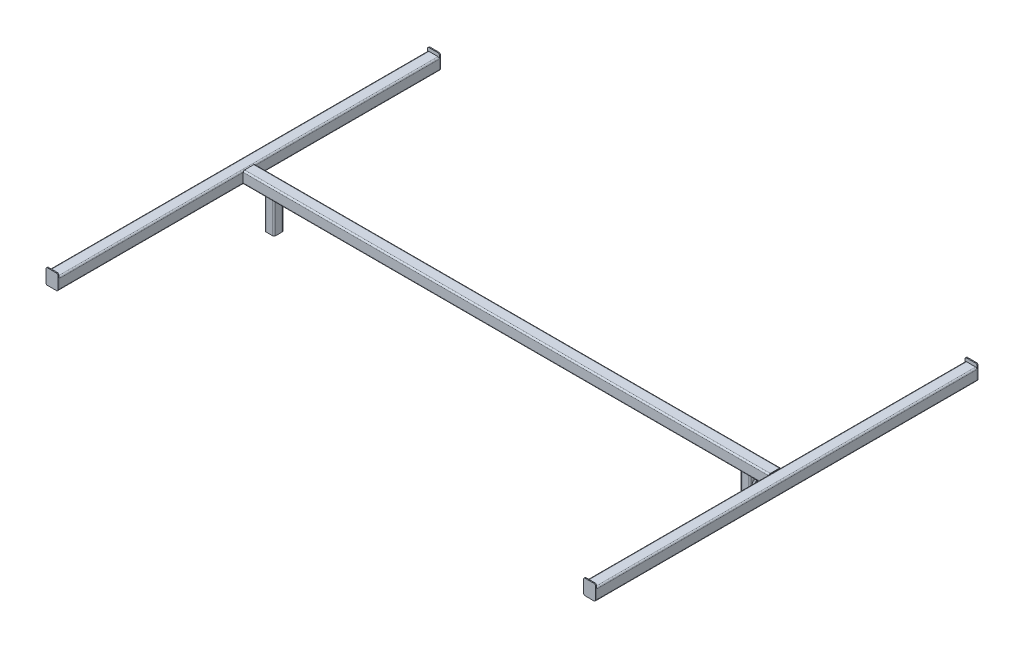
from build123d import *

# Parameters (mm, degrees)
F_2_X_2_X_0_25_1_DEPTH   = 800
F_2_X_2_X_0_25_1_2_DEPTH = 800
F_2_X_2_X_0_25_1_3_DEPTH = 1132
F_2_X_2_X_0_25_2_DEPTH   = 77.5
F_2_X_2_X_0_25_2_2_DEPTH = 77.5
EXTRUDE_1_DEPTH          = 2
CUT_EXTRUDE_3_DEPTH      = 1.5
CUT_EXTRUDE_4_DEPTH      = 1.5


with BuildPart() as part:
    # Sketch1 → Квадратная труба 2 X 2 X 0.25(1) (new body)
    with BuildSketch(Plane(origin=(-565, 0, -400), x_dir=(1, 0, 0), z_dir=(0, 0, 1))):
        with BuildLine():
            Line((-9.5, -12.5), (9.5, -12.5))
            ThreePointArc((9.5, -12.5), (11.621320344, -11.621320344), (12.5, -9.5))
            Line((12.5, -9.5), (12.5, 9.5))
            ThreePointArc((12.5, 9.5), (11.621320344, 11.621320344), (9.5, 12.5))
            Line((9.5, 12.5), (-9.5, 12.5))
            ThreePointArc((-9.5, 12.5), (-11.621320344, 11.621320344), (-12.5, 9.5))
            Line((-12.5, 9.5), (-12.5, -9.5))
            ThreePointArc((-12.5, -9.5), (-11.621320344, -11.621320344), (-9.5, -12.5))
        make_face()
        with BuildLine():
            Line((-9.5, -10.5), (9.5, -10.5))
            ThreePointArc((9.5, -10.5), (10.207106781, -10.207106781), (10.5, -9.5))
            Line((10.5, -9.5), (10.5, 9.5))
            ThreePointArc((10.5, 9.5), (10.207106781, 10.207106781), (9.5, 10.5))
            Line((9.5, 10.5), (-9.5, 10.5))
            ThreePointArc((-9.5, 10.5), (-10.207106781, 10.207106781), (-10.5, 9.5))
            Line((-10.5, 9.5), (-10.5, -9.5))
            ThreePointArc((-10.5, -9.5), (-10.207106781, -10.207106781), (-9.5, -10.5))
        make_face(mode=Mode.SUBTRACT)
    extrude(amount=F_2_X_2_X_0_25_1_DEPTH)


with BuildPart() as body_2:
    # Sketch1 on segment 2 (carried to segment 2) → 2 X 2 X 0.25_1 2 (new body)
    with BuildSketch(Plane(origin=(565, 0, -400), x_dir=(1, 0, 0), z_dir=(0, 0, 1))):
        with BuildLine():
            Line((-9.5, -12.5), (9.5, -12.5))
            ThreePointArc((9.5, -12.5), (11.621320344, -11.621320344), (12.5, -9.5))
            Line((12.5, -9.5), (12.5, 9.5))
            ThreePointArc((12.5, 9.5), (11.621320344, 11.621320344), (9.5, 12.5))
            Line((9.5, 12.5), (-9.5, 12.5))
            ThreePointArc((-9.5, 12.5), (-11.621320344, 11.621320344), (-12.5, 9.5))
            Line((-12.5, 9.5), (-12.5, -9.5))
            ThreePointArc((-12.5, -9.5), (-11.621320344, -11.621320344), (-9.5, -12.5))
        make_face()
        with BuildLine():
            Line((-9.5, -10.5), (9.5, -10.5))
            ThreePointArc((9.5, -10.5), (10.207106781, -10.207106781), (10.5, -9.5))
            Line((10.5, -9.5), (10.5, 9.5))
            ThreePointArc((10.5, 9.5), (10.207106781, 10.207106781), (9.5, 10.5))
            Line((9.5, 10.5), (-9.5, 10.5))
            ThreePointArc((-9.5, 10.5), (-10.207106781, 10.207106781), (-10.5, 9.5))
            Line((-10.5, 9.5), (-10.5, -9.5))
            ThreePointArc((-10.5, -9.5), (-10.207106781, -10.207106781), (-9.5, -10.5))
        make_face(mode=Mode.SUBTRACT)
    extrude(amount=F_2_X_2_X_0_25_1_2_DEPTH)


with BuildPart() as body_3:
    # Sketch1 on segment 3 (carried to segment 3) → 2 X 2 X 0.25_1 3 (new body)
    with BuildSketch(Plane(origin=(-566, 0, 0), x_dir=(0, 0, -1), z_dir=(1, 0, 0))):
        with BuildLine():
            Line((-9.5, -12.5), (9.5, -12.5))
            ThreePointArc((9.5, -12.5), (11.621320344, -11.621320344), (12.5, -9.5))
            Line((12.5, -9.5), (12.5, 9.5))
            ThreePointArc((12.5, 9.5), (11.621320344, 11.621320344), (9.5, 12.5))
            Line((9.5, 12.5), (-9.5, 12.5))
            ThreePointArc((-9.5, 12.5), (-11.621320344, 11.621320344), (-12.5, 9.5))
            Line((-12.5, 9.5), (-12.5, -9.5))
            ThreePointArc((-12.5, -9.5), (-11.621320344, -11.621320344), (-9.5, -12.5))
        make_face()
        with BuildLine():
            Line((-9.5, -10.5), (9.5, -10.5))
            ThreePointArc((9.5, -10.5), (10.207106781, -10.207106781), (10.5, -9.5))
            Line((10.5, -9.5), (10.5, 9.5))
            ThreePointArc((10.5, 9.5), (10.207106781, 10.207106781), (9.5, 10.5))
            Line((9.5, 10.5), (-9.5, 10.5))
            ThreePointArc((-9.5, 10.5), (-10.207106781, 10.207106781), (-10.5, 9.5))
            Line((-10.5, 9.5), (-10.5, -9.5))
            ThreePointArc((-10.5, -9.5), (-10.207106781, -10.207106781), (-9.5, -10.5))
        make_face(mode=Mode.SUBTRACT)
    extrude(amount=F_2_X_2_X_0_25_1_3_DEPTH)

    # 2 X 2 X 0.25_1 3 end butt 1
    split(bisect_by=Plane.YZ.offset(-552.5), keep=Keep.TOP)

    # 2 X 2 X 0.25_1 3 end butt 2
    split(bisect_by=Plane(origin=(552.5, 0, 0), x_dir=(0, -1, 0), z_dir=(-1, 0, 0)), keep=Keep.TOP)


with BuildPart() as body_4:
    # Sketch11 → Квадратная труба 2 X 2 X 0.25(2) (new body)
    with BuildSketch(Plane(origin=(-500, 0, 0), x_dir=(1, 0, 0), z_dir=(0, -1, 0))):
        with BuildLine():
            Line((-7, -10), (7, -10))
            ThreePointArc((7, -10), (9.121320344, -9.121320344), (10, -7))
            Line((10, -7), (10, 7))
            ThreePointArc((10, 7), (9.121320344, 9.121320344), (7, 10))
            Line((7, 10), (-7, 10))
            ThreePointArc((-7, 10), (-9.121320344, 9.121320344), (-10, 7))
            Line((-10, 7), (-10, -7))
            ThreePointArc((-10, -7), (-9.121320344, -9.121320344), (-7, -10))
        make_face()
        with BuildLine():
            Line((-7, -8.5), (7, -8.5))
            ThreePointArc((7, -8.5), (8.060660172, -8.060660172), (8.5, -7))
            Line((8.5, -7), (8.5, 7))
            ThreePointArc((8.5, 7), (8.060660172, 8.060660172), (7, 8.5))
            Line((7, 8.5), (-7, 8.5))
            ThreePointArc((-7, 8.5), (-8.060660172, 8.060660172), (-8.5, 7))
            Line((-8.5, 7), (-8.5, -7))
            ThreePointArc((-8.5, -7), (-8.060660172, -8.060660172), (-7, -8.5))
        make_face(mode=Mode.SUBTRACT)
    extrude(amount=F_2_X_2_X_0_25_2_DEPTH)

    # Weld Trim 2
    split(bisect_by=Plane.XZ.offset(12.5), keep=Keep.TOP)

    # Эскиз8 → Вырез-Вытянуть4 (cut)
    with BuildSketch(Plane.ZY.offset(510)):
        Polygon((2.655811238, -34.1), (5.311622477, -29.5), (2.655811238, -24.9), (-2.655811238, -24.9), (-5.311622477, -29.5), (-2.655811238, -34.1), align=None)
        Polygon((2.655811238, -64.1), (5.311622477, -59.5), (2.655811238, -54.9), (-2.655811238, -54.9), (-5.311622477, -59.5), (-2.655811238, -64.1), align=None)
    extrude(amount=-CUT_EXTRUDE_4_DEPTH, mode=Mode.SUBTRACT)


with BuildPart() as body_5:
    # Sketch11 on segment 2 (carried to segment 2) → 2 X 2 X 0.25_2 2 (new body)
    with BuildSketch(Plane(origin=(500, 0, 0), x_dir=(1, 0, 0), z_dir=(0, -1, 0))):
        with BuildLine():
            Line((-7, -10), (7, -10))
            ThreePointArc((7, -10), (9.121320344, -9.121320344), (10, -7))
            Line((10, -7), (10, 7))
            ThreePointArc((10, 7), (9.121320344, 9.121320344), (7, 10))
            Line((7, 10), (-7, 10))
            ThreePointArc((-7, 10), (-9.121320344, 9.121320344), (-10, 7))
            Line((-10, 7), (-10, -7))
            ThreePointArc((-10, -7), (-9.121320344, -9.121320344), (-7, -10))
        make_face()
        with BuildLine():
            Line((-7, -8.5), (7, -8.5))
            ThreePointArc((7, -8.5), (8.060660172, -8.060660172), (8.5, -7))
            Line((8.5, -7), (8.5, 7))
            ThreePointArc((8.5, 7), (8.060660172, 8.060660172), (7, 8.5))
            Line((7, 8.5), (-7, 8.5))
            ThreePointArc((-7, 8.5), (-8.060660172, 8.060660172), (-8.5, 7))
            Line((-8.5, 7), (-8.5, -7))
            ThreePointArc((-8.5, -7), (-8.060660172, -8.060660172), (-7, -8.5))
        make_face(mode=Mode.SUBTRACT)
    extrude(amount=F_2_X_2_X_0_25_2_2_DEPTH)

    # Weld Trim 2
    split(bisect_by=Plane.XZ.offset(12.5), keep=Keep.TOP)

    # Эскиз7 → Вырез-Вытянуть3 (cut)
    with BuildSketch(Plane(origin=(510, 0, 0), x_dir=(0, 0, -1), z_dir=(1, 0, 0))):
        Polygon((5.311622477, -29.5), (2.655811238, -24.9), (-2.655811238, -24.9), (-5.311622477, -29.5), (-2.655811238, -34.1), (2.655811238, -34.1), align=None)
        Polygon((5.311622477, -59.5), (2.655811238, -54.9), (-2.655811238, -54.9), (-5.311622477, -59.5), (-2.655811238, -64.1), (2.655811238, -64.1), align=None)
    extrude(amount=-CUT_EXTRUDE_3_DEPTH, mode=Mode.SUBTRACT)


with BuildPart() as body_6:
    # Эскиз5 → Бобышка-Вытянуть1 (new body)
    with BuildSketch(Plane.XY.offset(400)):
        with BuildLine():
            Line((-574.5, 19.5), (-555.5, 19.5))
            ThreePointArc((-555.5, 19.5), (-553.378679656, 18.621320344), (-552.5, 16.5))
            Line((-552.5, 16.5), (-552.5, -9.5))
            ThreePointArc((-552.5, -9.5), (-553.378679656, -11.621320344), (-555.5, -12.5))
            Line((-555.5, -12.5), (-574.5, -12.5))
            ThreePointArc((-574.5, -12.5), (-576.621320344, -11.621320344), (-577.5, -9.5))
            Line((-577.5, -9.5), (-577.5, 16.5))
            ThreePointArc((-577.5, 16.5), (-576.621320344, 18.621320344), (-574.5, 19.5))
        make_face()
    extrude(amount=EXTRUDE_1_DEPTH)


with BuildPart() as body_7:
    # Зеркальное отражение2: mirrored copy
    add(body_6.part.mirror(Plane(origin=(0, 0, 0), x_dir=(0, 0, 1), z_dir=(1, 0, 0))))


with BuildPart() as body_8:
    # Зеркальное отражение3: mirrored copy
    add(body_6.part.mirror(Plane.XY))


with BuildPart() as body_9:
    # Mirror 3 2: mirrored copy
    add(body_7.part.mirror(Plane.XY))


solid = Compound([part.part, body_2.part, body_3.part, body_4.part, body_5.part, body_6.part, body_7.part, body_8.part, body_9.part])
